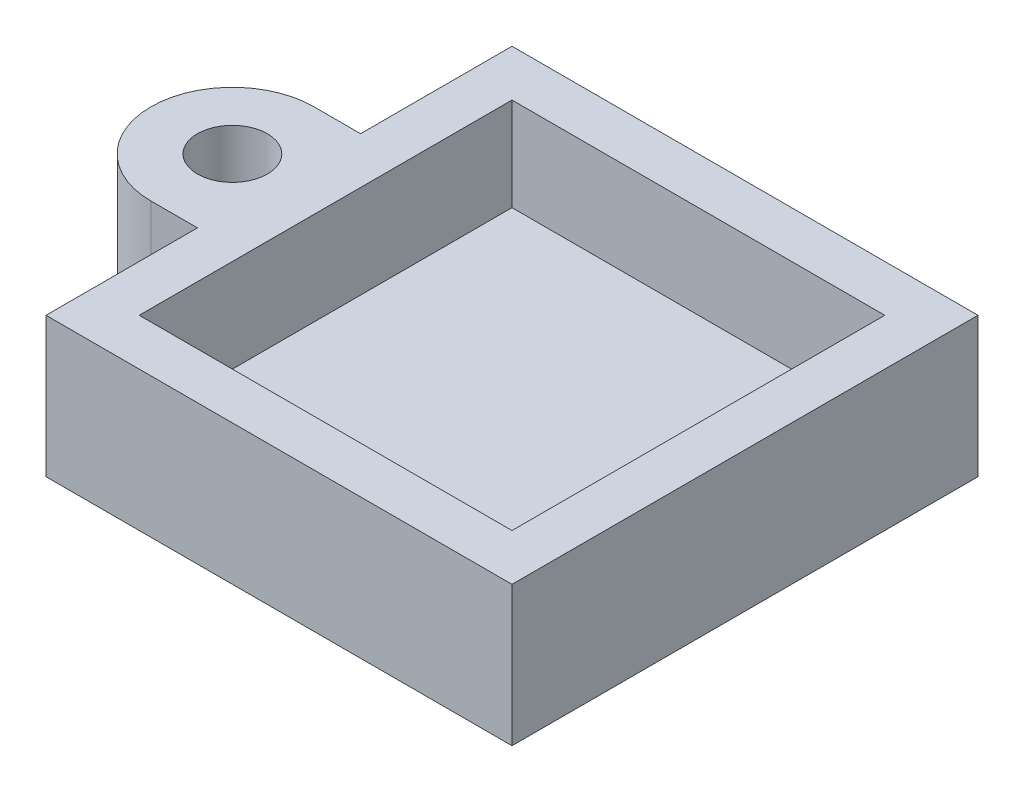
from build123d import *

# Parameters (mm, degrees)
SKETCH1_R           = 1.5
SKETCH1_W           = 16
SKETCH1_H           = 16
BOSS_EXTRUDE1_DEPTH = 4
BOSS_EXTRUDE2_START = 2
BOSS_EXTRUDE2_DEPTH = 2


with BuildPart() as part:
    # Sketch1 → Boss-Extrude1 (new body)
    with BuildSketch(Plane(origin=(0, 0, 0), x_dir=(1, 0, 0), z_dir=(0, 1, 0))):
        with BuildLine():
            Line((-2, 18), (18, 18))
            Line((18, 18), (18, -2))
            Line((18, -2), (-2, -2))
            Line((-2, -2), (-2, 4.5))
            Line((-2, 4.5), (-4, 4.5))
            ThreePointArc((-4, 4.5), (-7.5, 8), (-4, 11.5))
            Line((-4, 11.5), (-2, 11.5))
            Line((-2, 11.5), (-2, 18))
        make_face()
        with Locations(Location((-4, 8, 0), (0, 0, 270))):
            Circle(SKETCH1_R, mode=Mode.SUBTRACT)
        with Locations((8, 8)):
            Rectangle(SKETCH1_W, SKETCH1_H, mode=Mode.SUBTRACT)
    extrude(amount=BOSS_EXTRUDE1_DEPTH)

    # Sketch2 → Boss-Extrude2 (add)
    with BuildSketch(Plane.XZ.offset(BOSS_EXTRUDE2_START)):
        with BuildLine():
            Line((18, 2), (18, -18))
            Line((18, -18), (-2, -18))
            Line((-2, -18), (-2, -11.5))
            Line((-2, -11.5), (-4, -11.5))
            ThreePointArc((-4, -11.5), (-7.5, -8), (-4, -4.5))
            Line((-4, -4.5), (-2, -4.5))
            Line((-2, -4.5), (-2, 2))
            Line((-2, 2), (18, 2))
        make_face()
    extrude(amount=-BOSS_EXTRUDE2_DEPTH)


solid = part.part
